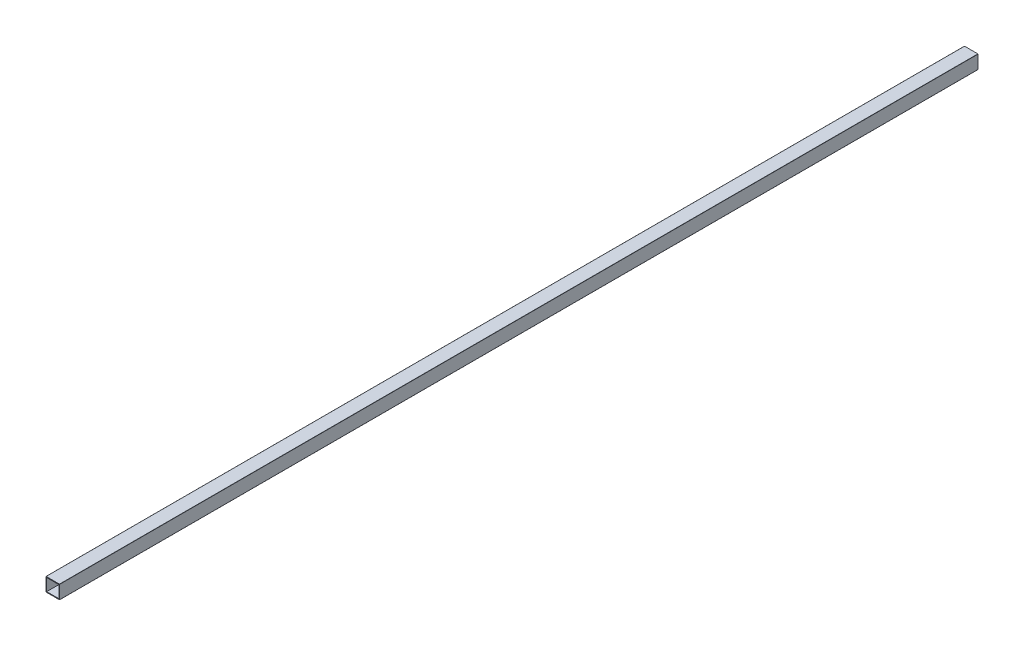
from build123d import *

# Parameters (mm, degrees)
CROQUIS1_W              = 79.8
CROQUIS1_H              = 79.8
SALIENTE_EXTRUIR1_DEPTH = 6000


with BuildPart() as part:
    # Croquis1 → Saliente-Extruir1 (new body)
    with BuildSketch(Plane.XY):
        with BuildLine():
            Line((-43.45, -44.45), (43.45, -44.45))
            ThreePointArc((43.45, -44.45), (44.157106781, -44.157106781), (44.45, -43.45))
            Line((44.45, -43.45), (44.45, 43.45))
            ThreePointArc((44.45, 43.45), (44.157106781, 44.157106781), (43.45, 44.45))
            Line((43.45, 44.45), (-43.45, 44.45))
            ThreePointArc((-43.45, 44.45), (-44.157106781, 44.157106781), (-44.45, 43.45))
            Line((-44.45, 43.45), (-44.45, -43.45))
            ThreePointArc((-44.45, -43.45), (-44.157106781, -44.157106781), (-43.45, -44.45))
        make_face()
        Rectangle(CROQUIS1_W, CROQUIS1_H, mode=Mode.SUBTRACT)
    extrude(amount=SALIENTE_EXTRUIR1_DEPTH)


solid = part.part
